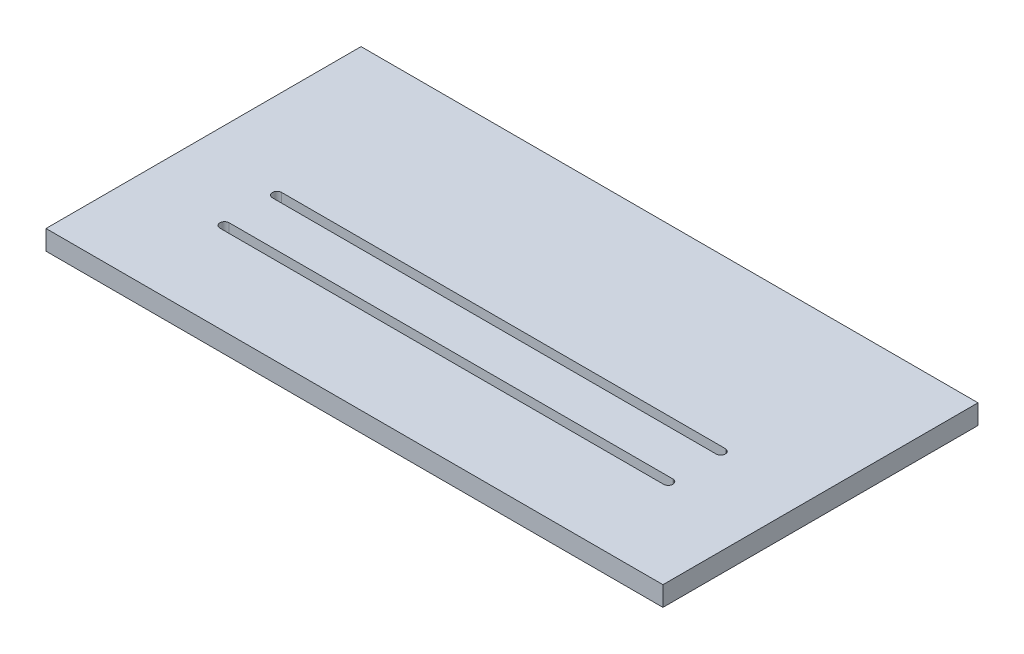
from build123d import *

# Parameters (mm, degrees)
SKETCH1_W           = 298.45
SKETCH1_H           = 152.4
BOSS_EXTRUDE1_DEPTH = 4.7625
CUT_EXTRUDE2_DEPTH  = 168.825106137


with BuildPart() as part:
    # Sketch1 → Boss-Extrude1 (new, symmetric)
    with BuildSketch(Plane(origin=(0, 0, 0), x_dir=(1, 0, 0), z_dir=(0, 1, 0))):
        Rectangle(SKETCH1_W, SKETCH1_H)
    extrude(amount=BOSS_EXTRUDE1_DEPTH, both=True)

    # Sketch4 → Cut-Extrude2 (cut, through all)
    with BuildSketch(Plane.XZ.offset(4.7625)):
        with BuildLine():
            Line((-107.315, 33.9979), (107.315, 33.9979))
            ThreePointArc((107.315, 33.9979), (109.5629, 31.75), (107.315, 29.5021))
            Line((107.315, 29.5021), (-107.315, 29.5021))
            ThreePointArc((-107.315, 29.5021), (-109.5629, 31.75), (-107.315, 33.9979))
        make_face()
        with BuildLine():
            Line((-107.315, 8.5979), (107.315, 8.5979))
            ThreePointArc((107.315, 8.5979), (109.5629, 6.35), (107.315, 4.1021))
            Line((107.315, 4.1021), (-107.315, 4.1021))
            ThreePointArc((-107.315, 4.1021), (-109.5629, 6.35), (-107.315, 8.5979))
        make_face()
    extrude(amount=-CUT_EXTRUDE2_DEPTH, mode=Mode.SUBTRACT)


solid = part.part
